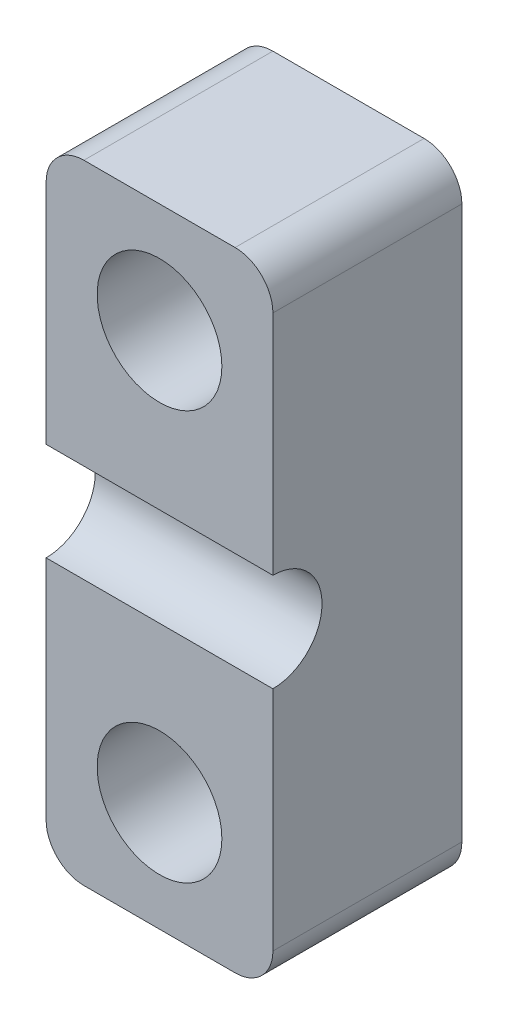
from build123d import *

# Parameters (mm, degrees)
SKETCH1_R           = 1.65
BOSS_EXTRUDE1_DEPTH = 5
CUT_EXTRUDE1_DEPTH  = 6


with BuildPart() as part:
    # Sketch1 → Boss-Extrude1 (new body)
    with BuildSketch(Plane.XY):
        with BuildLine():
            Line((-2, -8.31), (2, -8.31))
            ThreePointArc((2, -8.31), (2.707106781, -8.017106781), (3, -7.31))
            Line((3, -7.31), (3, 7.31))
            ThreePointArc((3, 7.31), (2.707106781, 8.017106781), (2, 8.31))
            Line((2, 8.31), (-2, 8.31))
            ThreePointArc((-2, 8.31), (-2.707106781, 8.017106781), (-3, 7.31))
            Line((-3, 7.31), (-3, -7.31))
            ThreePointArc((-3, -7.31), (-2.707106781, -8.017106781), (-2, -8.31))
        make_face()
        with Locations((0, -5.41)):
            Circle(SKETCH1_R, mode=Mode.SUBTRACT)
        with Locations((0, 5.41)):
            Circle(SKETCH1_R, mode=Mode.SUBTRACT)
    extrude(amount=BOSS_EXTRUDE1_DEPTH)

    # Sketch2 → Cut-Extrude1 (cut)
    with BuildSketch(Plane(origin=(3, 0, 0), x_dir=(0, 0, -1), z_dir=(1, 0, 0))):
        with BuildLine():
            Line((-5, -1.3), (-5, 1.3))
            ThreePointArc((-5, 1.3), (-3.7, 0), (-5, -1.3))
        make_face()
    extrude(amount=-CUT_EXTRUDE1_DEPTH, mode=Mode.SUBTRACT)


solid = part.part
